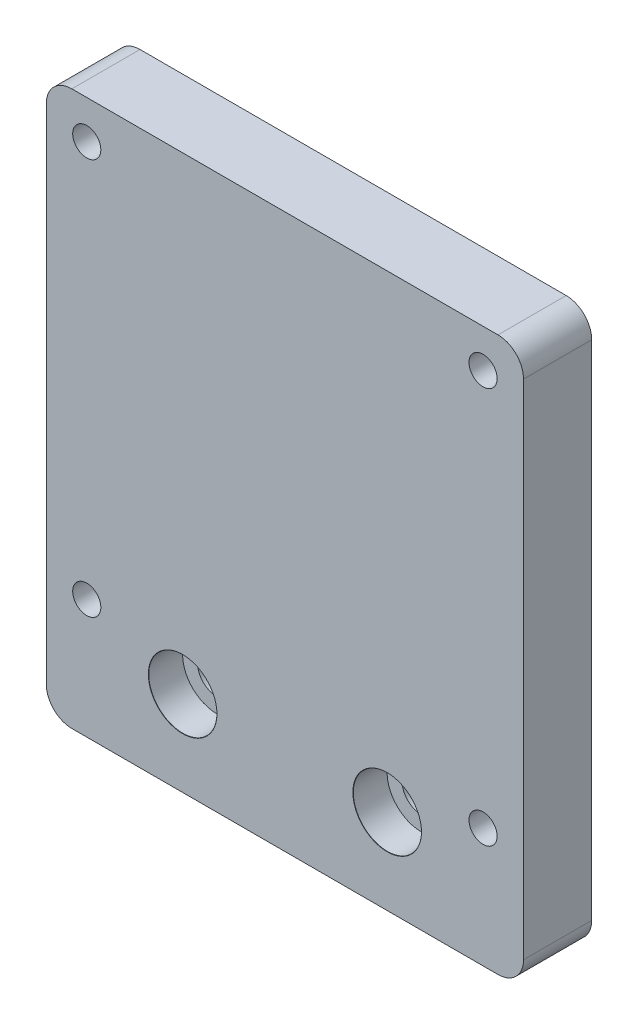
from build123d import *

# Parameters (mm, degrees)
SKETCH1_W                     = 56
SKETCH1_H                     = 65
BOSS_EXTRUDE1_DEPTH           = 8
FILLET1_R                     = 3
CBORE_FOR_M4_SHCS1_AT_2_COUNT = 2
CBORE_FOR_M4_SHCS1_AT_2_PITCH = 24
M4X0_7_TAPPED_HOLE1_D         = 3.3
M4X0_7_TAPPED_HOLE1_DEPTH     = 10.1
M4X0_7_TAPPED_HOLE1_TIP       = 0.991420021


with BuildPart() as part:
    # Sketch1 → Boss-Extrude1 (new body)
    with BuildSketch(Plane.XY):
        Rectangle(SKETCH1_W, SKETCH1_H)
    extrude(amount=BOSS_EXTRUDE1_DEPTH)

    # Fillet1
    fillet1_edges = [part.edges().sort_by_distance(p)[0] for p in [
        (28, -32.5, 4),
        (-28, -32.5, 4),
        (-28, 32.5, 4),
        (28, 32.5, 4),
    ]]
    fillet(fillet1_edges, radius=FILLET1_R)

    # Sketch3 → CBORE for M4 SHCS1 (revolve, cut)
    with BuildSketch(Plane(origin=(-12, -22.5, 8), x_dir=(0, -1, 0), z_dir=(1, 0, 0))):
        Polygon((0, 0), (0, 8), (2.25, 8), (2.25, 4), (4, 4), (4, 0.025), (4.025, 0), align=None)
    cbore_for_m4_shcs1 = revolve(axis=Axis((-12, -22.5, 14.35), (0, 0, -1)), mode=Mode.SUBTRACT)

    # CBORE for M4 SHCS1 at 2: CBORE for M4 SHCS1 ×2
    with Locations(*[(i * CBORE_FOR_M4_SHCS1_AT_2_PITCH, 0, 0) for i in range(1, CBORE_FOR_M4_SHCS1_AT_2_COUNT)]):
        add(cbore_for_m4_shcs1, mode=Mode.SUBTRACT)

    # M4x0.7 Tapped Hole1
    with Locations(Plane.XY.offset(8)):
        with Locations((-23.25, -18.5), (23.25, -18.5), (23.25, 28), (-23.25, 28)):
            Hole(M4X0_7_TAPPED_HOLE1_D / 2, depth=M4X0_7_TAPPED_HOLE1_DEPTH)
            with Locations((0, 0, -(M4X0_7_TAPPED_HOLE1_DEPTH + M4X0_7_TAPPED_HOLE1_TIP / 2))):  # 118° drill point
                Cone(0, M4X0_7_TAPPED_HOLE1_D / 2, M4X0_7_TAPPED_HOLE1_TIP, mode=Mode.SUBTRACT)


solid = part.part
